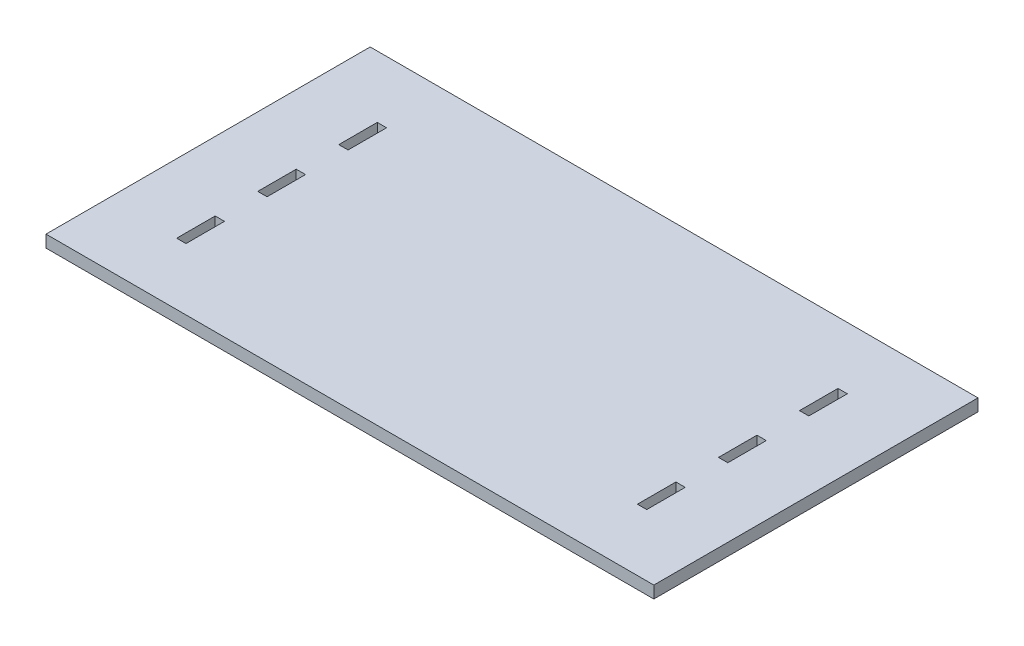
from build123d import *

# Parameters (mm, degrees)
CROQUIS1_W              = 150
CROQUIS1_H              = 80
CROQUIS1_W_2            = 2.3
CROQUIS1_H_2            = 9.5
SALIENTE_EXTRUIR1_DEPTH = 3


with BuildPart() as part:
    # Croquis1 → Saliente-Extruir1 (new body)
    with BuildSketch(Plane(origin=(0, 0, 0), x_dir=(1, 0, 0), z_dir=(0, 1, 0))):
        Rectangle(CROQUIS1_W, CROQUIS1_H)
        with Locations((56.85, 20)):
            Rectangle(CROQUIS1_W_2, CROQUIS1_H_2, mode=Mode.SUBTRACT)
        with Locations((56.85, 0)):
            Rectangle(CROQUIS1_W_2, CROQUIS1_H_2, mode=Mode.SUBTRACT)
        with Locations((56.85, -20)):
            Rectangle(CROQUIS1_W_2, CROQUIS1_H_2, mode=Mode.SUBTRACT)
        with Locations((-56.85, 20)):
            Rectangle(CROQUIS1_W_2, CROQUIS1_H_2, mode=Mode.SUBTRACT)
        with Locations((-56.85, -20)):
            Rectangle(CROQUIS1_W_2, CROQUIS1_H_2, mode=Mode.SUBTRACT)
        with Locations((-56.85, 0)):
            Rectangle(CROQUIS1_W_2, CROQUIS1_H_2, mode=Mode.SUBTRACT)
    extrude(amount=SALIENTE_EXTRUIR1_DEPTH)


solid = part.part
